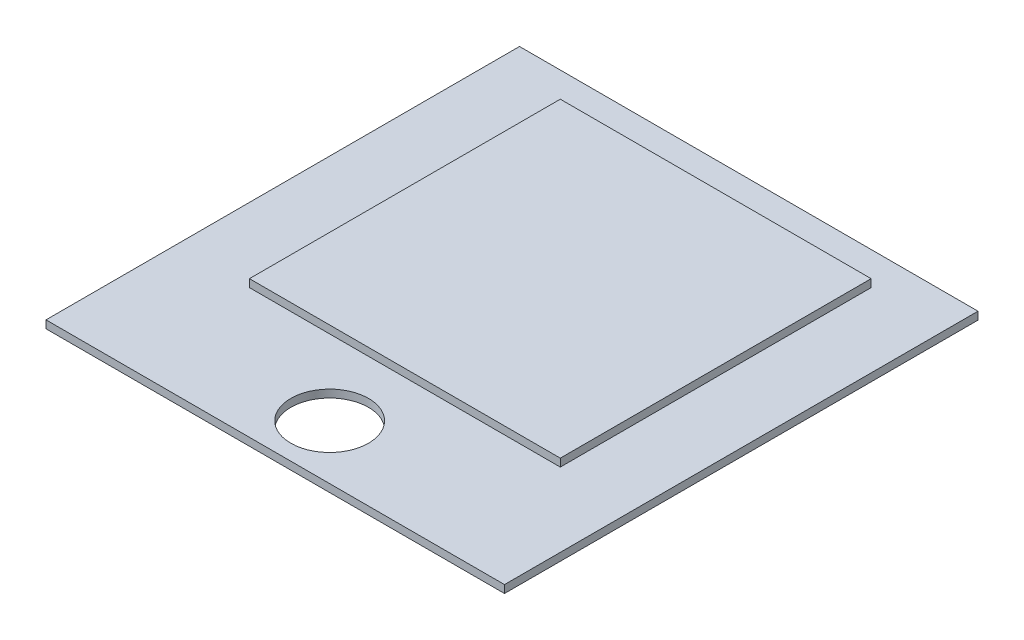
from build123d import *

# Parameters (mm, degrees)
SKETCH1_W           = 590
SKETCH1_H           = 609.3
BOSS_EXTRUDE1_DEPTH = 10
SKETCH2_R           = 50
CUT_EXTRUDE3_DEPTH  = 425.189371036
SKETCH3_W           = 400
SKETCH3_H           = 400
BOSS_EXTRUDE6_DEPTH = 10


with BuildPart() as part:
    # Sketch1 → Boss-Extrude1 (new body)
    with BuildSketch(Plane(origin=(0, 0, 0), x_dir=(1, 0, 0), z_dir=(0, 1, 0))):
        Rectangle(SKETCH1_W, SKETCH1_H)
    extrude(amount=BOSS_EXTRUDE1_DEPTH)

    # Sketch2 → Cut-Extrude3 (cut, through all)
    with BuildSketch(Plane(origin=(0, 10, 0), x_dir=(1, 0, 0), z_dir=(0, 1, 0))):
        with Locations(Location((0, -234.65, 0), (0, 0, 270))):
            Circle(SKETCH2_R)
    extrude(amount=-CUT_EXTRUDE3_DEPTH, mode=Mode.SUBTRACT)

    # Sketch3 → Boss-Extrude6 (add)
    with BuildSketch(Plane(origin=(0, 10, -62.246477908), x_dir=(1, 0, 0), z_dir=(0, 1, 0))):
        with Locations((0, -0.096477908)):
            Rectangle(SKETCH3_W, SKETCH3_H)
    extrude(amount=BOSS_EXTRUDE6_DEPTH)


solid = part.part
